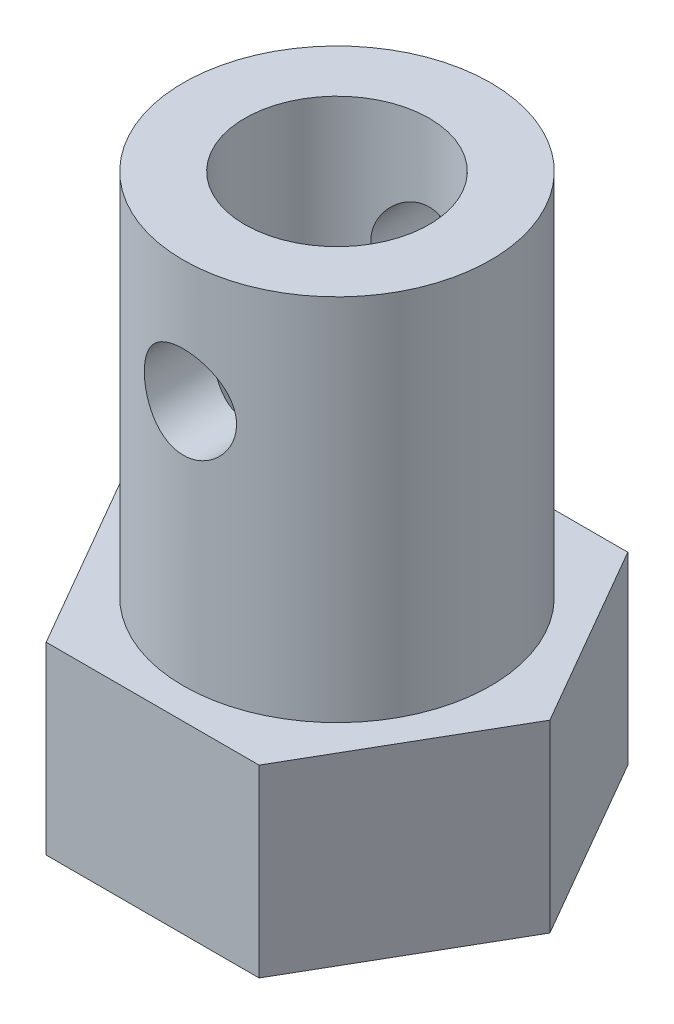
from build123d import *

# Parameters (mm, degrees)
BOSS_EXTRUDE1_DEPTH     = 6
SKETCH3_R               = 5
BOSS_EXTRUDE2_DEPTH     = 12
SKETCH4_R               = 3
CUT_EXTRUDE1_DEPTH      = 14.4
CUT_EXTRUDE2_DEPTH      = 21.199009877
CUT_EXTRUDE2_DEPTH_BACK = 21.199009877
SKETCH5_R               = 1.5
SKETCH6_R               = 1.5
CUT_EXTRUDE3_DEPTH      = 14.4


with BuildPart() as part:
    # Sketch1 → Boss-Extrude1 (new body)
    with BuildSketch(Plane(origin=(0, 0, 0), x_dir=(1, 0, 0), z_dir=(0, 1, 0))):
        Polygon((6.92820323, 0), (3.464101615, 6), (-3.464101615, 6), (-6.92820323, 0), (-3.464101615, -6), (3.464101615, -6), align=None)
    extrude(amount=BOSS_EXTRUDE1_DEPTH)

    # Sketch3 → Boss-Extrude2 (add)
    with BuildSketch(Plane(origin=(0, 6, 0), x_dir=(1, 0, 0), z_dir=(0, 1, 0))):
        with Locations(Location((0, 0, 0), (0, 0, 270))):
            Circle(SKETCH3_R)
    extrude(amount=BOSS_EXTRUDE2_DEPTH)

    # Sketch4 → Cut-Extrude1 (cut)
    with BuildSketch(Plane(origin=(0, 18, 0), x_dir=(1, 0, 0), z_dir=(0, 1, 0))):
        with Locations(Location((0, 0, 0), (0, 0, 270))):
            Circle(SKETCH4_R)
    extrude(amount=-CUT_EXTRUDE1_DEPTH, mode=Mode.SUBTRACT)

    # Sketch5 → Cut-Extrude2 (cut, two sides: drawn at the far end of the back side and taken through both)
    with BuildSketch(Plane.XY.offset(-CUT_EXTRUDE2_DEPTH_BACK)):
        with Locations((0, 14)):
            Circle(SKETCH5_R)
    extrude(amount=CUT_EXTRUDE2_DEPTH + CUT_EXTRUDE2_DEPTH_BACK, mode=Mode.SUBTRACT)

    # Sketch6 → Cut-Extrude3 (cut)
    with BuildSketch(Plane.XZ):
        with Locations(Location((0, 0, 0), (0, 0, 270))):
            Circle(SKETCH6_R)
    extrude(amount=-CUT_EXTRUDE3_DEPTH, mode=Mode.SUBTRACT)


solid = part.part
